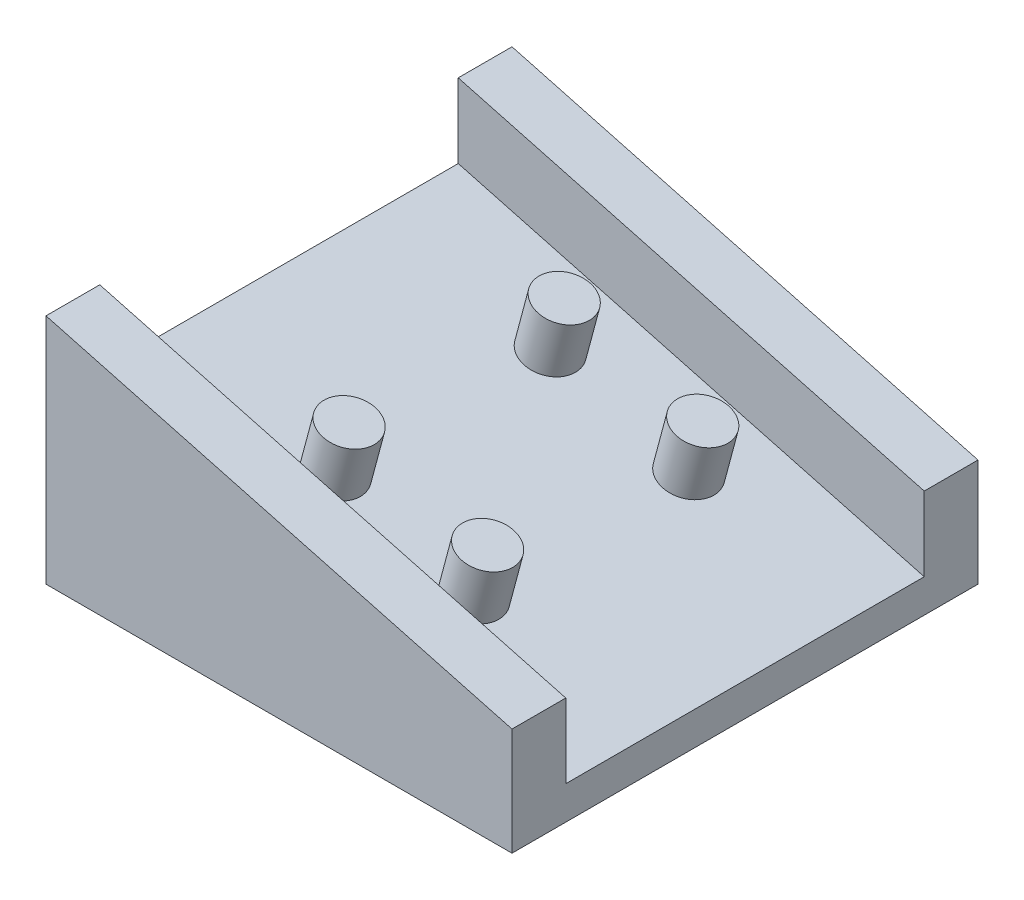
from build123d import *

# Parameters (mm, degrees)
SKETCH1_W           = 26
SKETCH1_H           = 26
BOSS_EXTRUDE1_DEPTH = 12.966679003
CUT_EXTRUDE1_DEPTH  = 39.988905658
SKETCH3_W           = 50
SKETCH3_H           = 20
CUT_EXTRUDE2_DEPTH  = 4
SKETCH5_R           = 1.45
BOSS_EXTRUDE2_DEPTH = 3


with BuildPart() as part:
    # Sketch1 → Boss-Extrude1 (new body)
    with BuildSketch(Plane(origin=(0, 0, 0), x_dir=(1, 0, 0), z_dir=(0, 1, 0))):
        with Locations((13, 13)):
            Rectangle(SKETCH1_W, SKETCH1_H)
    extrude(amount=BOSS_EXTRUDE1_DEPTH)

    # Sketch2 → Cut-Extrude1 (cut, through all)
    with BuildSketch(Plane.XY):
        Polygon((0, 12.966679003), (26, 6), (26, 12.966679003), align=None)
    extrude(amount=-CUT_EXTRUDE1_DEPTH, mode=Mode.SUBTRACT)

    # Sketch3 → Cut-Extrude2 (cut)
    with BuildSketch(Plane(origin=(3.241669751, 12.098076211, 0), x_dir=(0.9659258262890681, -0.25881904510252174, 0), z_dir=(0.2588190451025217, 0.965925826289068, 0))):
        with Locations((21.643976522, 13)):
            Rectangle(SKETCH3_W, SKETCH3_H)
    extrude(amount=-CUT_EXTRUDE2_DEPTH, mode=Mode.SUBTRACT)

    # Sketch5 → Boss-Extrude2 (add)
    with BuildSketch(Plane(origin=(2.20639357, 8.234372906, 0), x_dir=(0.9659258262890681, -0.2588190451025218, 0), z_dir=(0.25881904510252174, 0.965925826289068, 0))):
        with Locations((7.174363637, 19)):
            Circle(SKETCH5_R)
        with Locations((7.174363637, 7)):
            Circle(SKETCH5_R)
        with Locations((15.174363637, 19)):
            Circle(SKETCH5_R)
        with Locations((15.174363637, 7)):
            Circle(SKETCH5_R)
    extrude(amount=BOSS_EXTRUDE2_DEPTH)


solid = part.part
